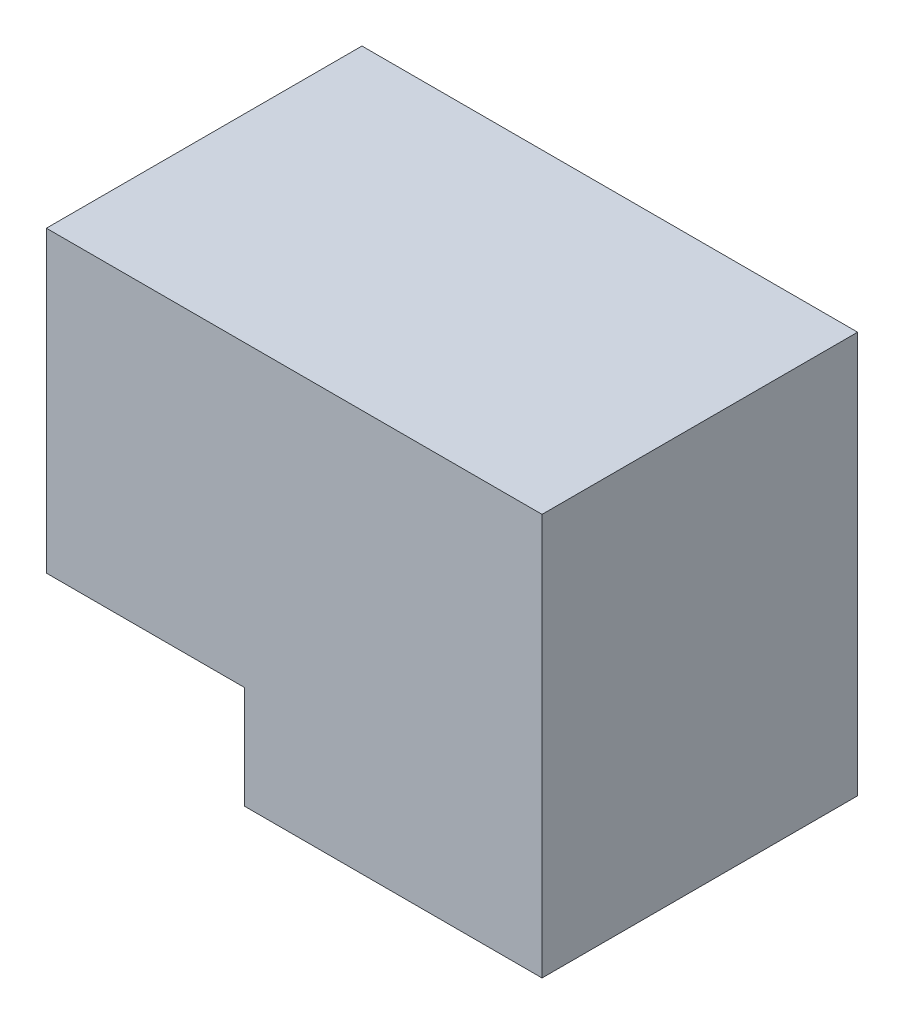
from build123d import *

# Parameters (mm, degrees)
BOSS_EXTRUDE1_DEPTH = 30


with BuildPart() as part:
    # Sketch1 → Boss-Extrude1 (new body)
    with BuildSketch(Plane.XY):
        Polygon((0, 0), (18.811935171, 0), (18.811935171, -9.77124788), (47.121158001, -9.77124788), (47.121158001, 28.400542904), (0, 28.400542904), align=None)
    extrude(amount=BOSS_EXTRUDE1_DEPTH)


solid = part.part
